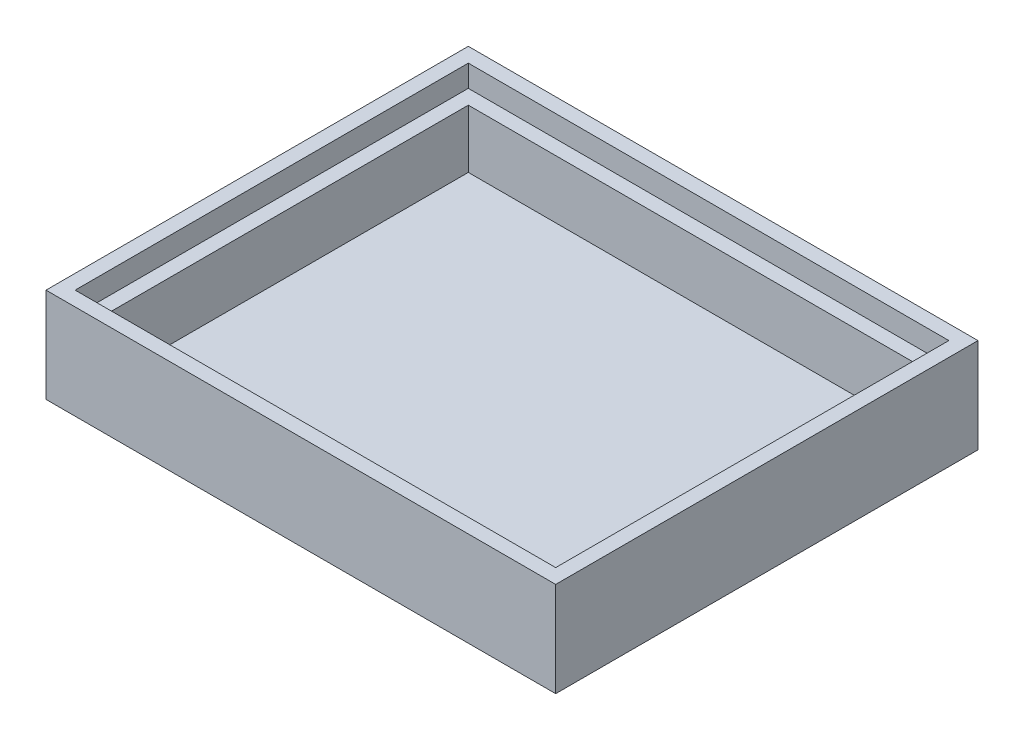
from build123d import *

# Parameters (mm, degrees)
SZKIC1_W                    = 70
SZKIC1_H                    = 58
DODANIE_WYCI_GNI_CIE1_DEPTH = 2
SZKIC2_W                    = 70
SZKIC2_H                    = 58
SZKIC2_W_2                  = 62
SZKIC2_H_2                  = 50
DODANIE_WYCI_GNI_CIE2_DEPTH = 8
SZKIC3_W                    = 70
SZKIC3_H                    = 58
SZKIC3_W_2                  = 66
SZKIC3_H_2                  = 54
DODANIE_WYCI_GNI_CIE3_DEPTH = 3


with BuildPart() as part:
    # Szkic1 → Dodanie-wyciągnięcie1 (new body)
    with BuildSketch(Plane(origin=(0, 0, 0), x_dir=(1, 0, 0), z_dir=(0, 1, 0))):
        with Locations((35, 29)):
            Rectangle(SZKIC1_W, SZKIC1_H)
    extrude(amount=DODANIE_WYCI_GNI_CIE1_DEPTH)

    # Szkic2 → Dodanie-wyciągnięcie2 (add)
    with BuildSketch(Plane(origin=(0, 2, 0), x_dir=(1, 0, 0), z_dir=(0, 1, 0))):
        with Locations((35, 29)):
            Rectangle(SZKIC2_W, SZKIC2_H)
        with Locations((35, 29)):
            Rectangle(SZKIC2_W_2, SZKIC2_H_2, mode=Mode.SUBTRACT)
    extrude(amount=DODANIE_WYCI_GNI_CIE2_DEPTH)

    # Szkic3 → Dodanie-wyciągnięcie3 (add)
    with BuildSketch(Plane(origin=(0, 10, 0), x_dir=(1, 0, 0), z_dir=(0, 1, 0))):
        with Locations((35, 29)):
            Rectangle(SZKIC3_W, SZKIC3_H)
        with Locations((35, 29)):
            Rectangle(SZKIC3_W_2, SZKIC3_H_2, mode=Mode.SUBTRACT)
    extrude(amount=DODANIE_WYCI_GNI_CIE3_DEPTH)


solid = part.part
